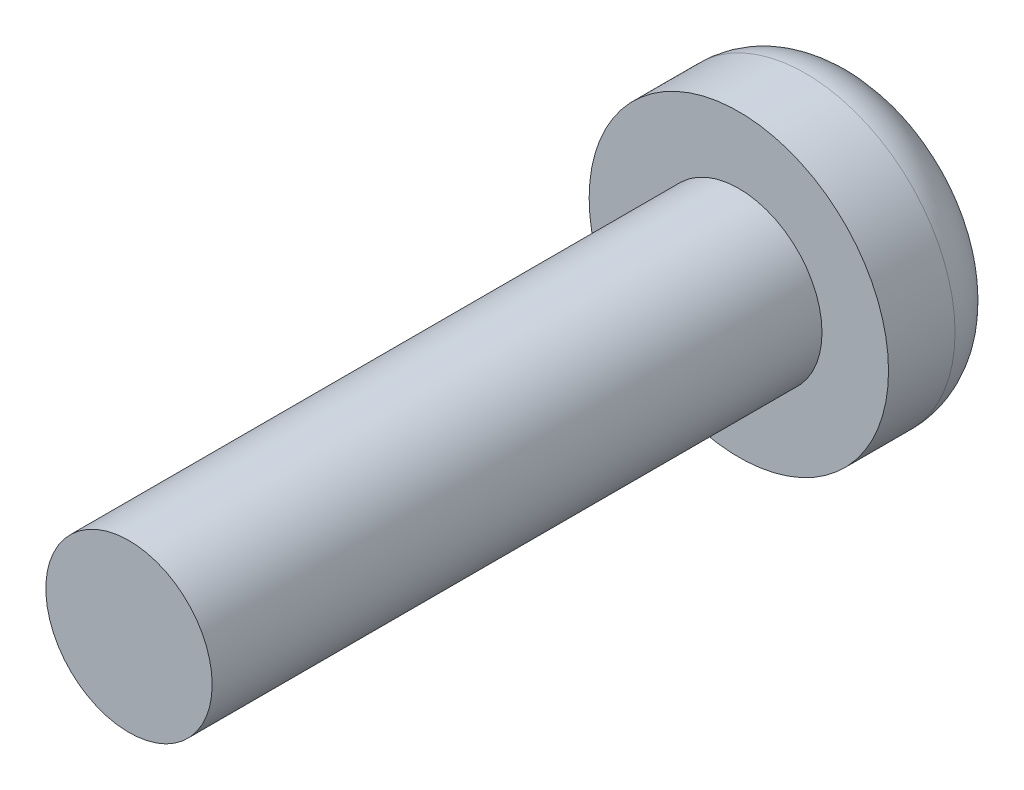
from build123d import *

# Parameters (mm, degrees)
SKETCH_1_R      = 1.5
EXTRUDE_1_DEPTH = 11
SKETCH_2_R      = 2.7
EXTRUDE_2_DEPTH = 2.2
FILLET_1_R      = 1


with BuildPart() as part:
    # 草图1 → 凸台-拉伸1 (new body)
    with BuildSketch(Plane.XY):
        Circle(SKETCH_1_R)
    extrude(amount=EXTRUDE_1_DEPTH)

    # 草图2 → 凸台-拉伸2 (add)
    with BuildSketch(Plane(origin=(0, 0, 0), x_dir=(-1, 0, 0), z_dir=(0, 0, -1))):
        Circle(SKETCH_2_R)
    extrude(amount=EXTRUDE_2_DEPTH)

    # 圆角1
    fillet_1_edges = [part.edges().sort_by_distance(p)[0] for p in [
        (2.7, 0, -2.2),
    ]]
    fillet(fillet_1_edges, radius=FILLET_1_R)


solid = part.part
